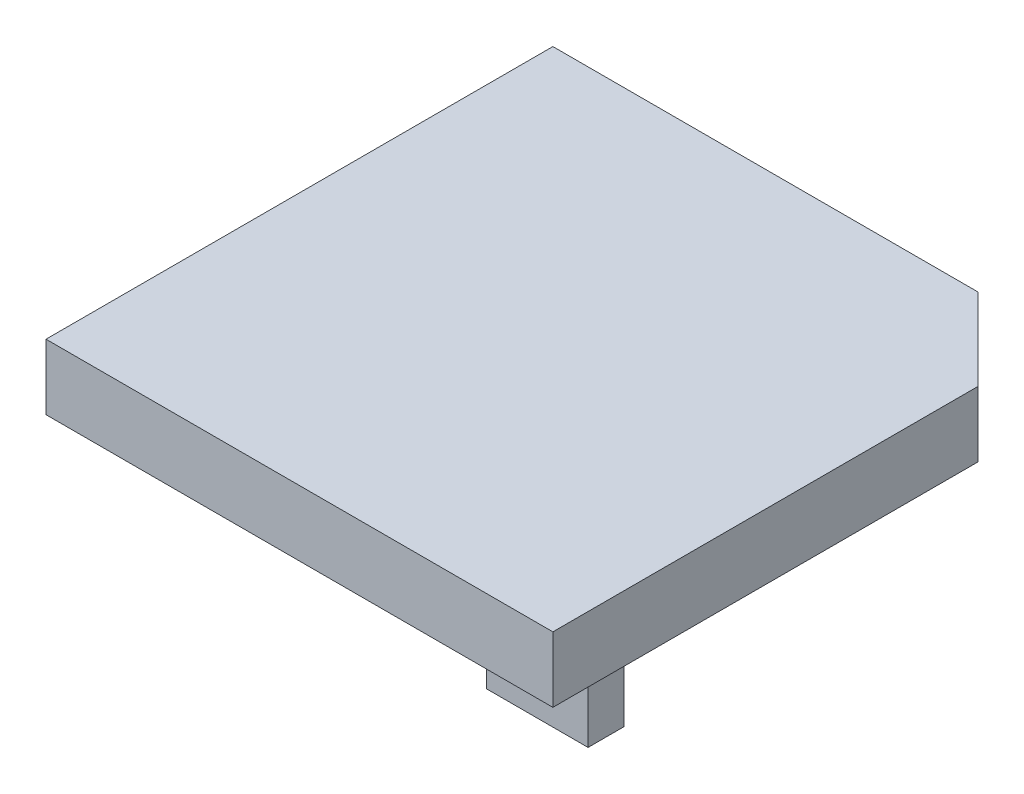
from build123d import *

# Parameters (mm, degrees)
SKETCH1_W           = 19.685
SKETCH1_H           = 19.685
BOSS_EXTRUDE1_DEPTH = 2.54
SKETCH3_W           = 1.397
SKETCH3_H           = 3.937
SKETCH3_W_2         = 3.937
SKETCH3_H_2         = 1.397
BOSS_EXTRUDE2_DEPTH = 4.572
CHAMFER1_SIZE       = 3.175


with BuildPart() as part:
    # Sketch1 → Boss-Extrude1 (new body)
    with BuildSketch(Plane(origin=(0, 0, 0), x_dir=(1, 0, 0), z_dir=(0, 1, 0))):
        Rectangle(SKETCH1_W, SKETCH1_H)
    extrude(amount=BOSS_EXTRUDE1_DEPTH)

    # Sketch3 → Boss-Extrude2 (add)
    with BuildSketch(Plane.XZ):
        with Locations((-4.98475, -5.08)):
            Rectangle(SKETCH3_W, SKETCH3_H)
        with Locations((5.334, 5.23748)):
            Rectangle(SKETCH3_W_2, SKETCH3_H_2)
    extrude(amount=BOSS_EXTRUDE2_DEPTH)

    # Chamfer1
    chamfer1_edges = [part.edges().sort_by_distance(p)[0] for p in [
        (9.8425, 1.27, -9.8425),
    ]]
    chamfer(chamfer1_edges, length=CHAMFER1_SIZE)


solid = part.part
